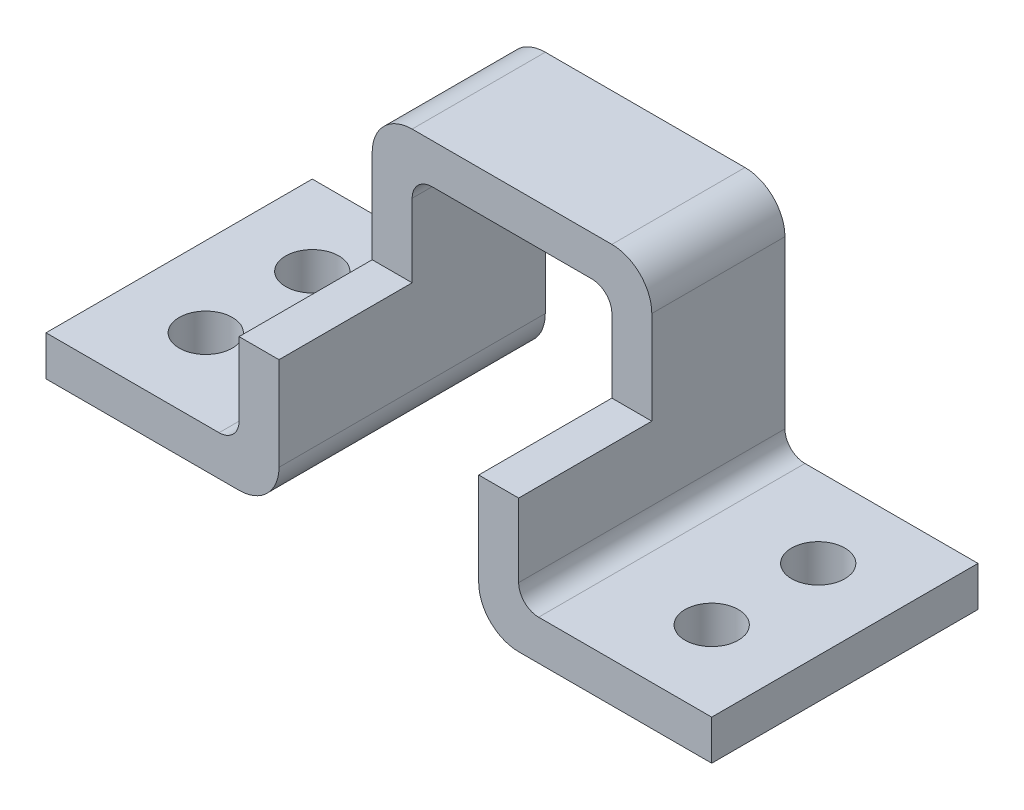
from build123d import *

# Parameters (mm, degrees)
BOSS_EXTRUDE1_DEPTH = 40
CUT_EXTRUDE1_START  = -20
CUT_EXTRUDE1_DEPTH  = 20
CUT_EXTRUDE2_REACH  = 114.942
SKETCH3_R           = 4


with BuildPart() as part:
    # Sketch1 → Boss-Extrude1 (new body)
    with BuildSketch(Plane.XY):
        with BuildLine():
            Line((0, 6), (0, 0))
            Line((0, 0), (29, 0))
            ThreePointArc((29, 0), (33.242640687, 1.757359313), (35, 6))
            Line((35, 6), (35, 31))
            ThreePointArc((35, 31), (35.878679656, 33.121320344), (38, 34))
            Line((38, 34), (62, 34))
            ThreePointArc((62, 34), (64.121320344, 33.121320344), (65, 31))
            Line((65, 31), (65, 6))
            ThreePointArc((65, 6), (66.757359313, 1.757359313), (71, 0))
            Line((71, 0), (100, 0))
            Line((100, 0), (100, 6))
            Line((100, 6), (74, 6))
            ThreePointArc((74, 6), (71.878679656, 6.878679656), (71, 9))
            Line((71, 9), (71, 34))
            ThreePointArc((71, 34), (69.242640687, 38.242640687), (65, 40))
            Line((65, 40), (35, 40))
            ThreePointArc((35, 40), (30.757359313, 38.242640687), (29, 34))
            Line((29, 34), (29, 9))
            ThreePointArc((29, 9), (28.121320344, 6.878679656), (26, 6))
            Line((26, 6), (0, 6))
        make_face()
    extrude(amount=BOSS_EXTRUDE1_DEPTH)

    # Sketch2 → Cut-Extrude1 (cut)
    with BuildSketch(Plane.XY.offset(40).offset(CUT_EXTRUDE1_START)):
        with BuildLine():
            Line((29, 20), (35, 20))
            Line((35, 20), (35, 31))
            ThreePointArc((35, 31), (35.878679656, 33.121320344), (38, 34))
            Line((38, 34), (62, 34))
            ThreePointArc((62, 34), (64.121320344, 33.121320344), (65, 31))
            Line((65, 31), (65, 20))
            Line((65, 20), (71, 20))
            Line((71, 20), (71, 34))
            ThreePointArc((71, 34), (69.242640687, 38.242640687), (65, 40))
            Line((65, 40), (35, 40))
            ThreePointArc((35, 40), (30.757359313, 38.242640687), (29, 34))
            Line((29, 34), (29, 20))
        make_face()
    extrude(amount=CUT_EXTRUDE1_DEPTH, mode=Mode.SUBTRACT)

    # Sketch3 → Cut-Extrude2 (cut, up to next)
    with BuildSketch(Plane(origin=(0, 6, 0), x_dir=(1, 0, 0), z_dir=(0, 1, 0)), mode=Mode.PRIVATE) as cut_extrude2_sk1:
        with Locations(Location((12, -12, 0), (0, 0, 180))):
            Circle(SKETCH3_R)
    cut_extrude2_tool1 = extrude(cut_extrude2_sk1.sketch, amount=-CUT_EXTRUDE2_REACH, mode=Mode.PRIVATE) & part.part
    # Sketch3 → Cut-Extrude2 (cut, up to next)
    with BuildSketch(Plane(origin=(0, 6, 0), x_dir=(1, 0, 0), z_dir=(0, 1, 0)), mode=Mode.PRIVATE) as cut_extrude2_sk2:
        with Locations(Location((12, -28, 0), (0, 0, 180))):
            Circle(SKETCH3_R)
    cut_extrude2_tool2 = extrude(cut_extrude2_sk2.sketch, amount=-CUT_EXTRUDE2_REACH, mode=Mode.PRIVATE) & part.part
    # Sketch3 → Cut-Extrude2 (cut, up to next)
    with BuildSketch(Plane(origin=(0, 6, 0), x_dir=(1, 0, 0), z_dir=(0, 1, 0)), mode=Mode.PRIVATE) as cut_extrude2_sk3:
        with Locations(Location((88, -12, 0), (0, 0, 180))):
            Circle(SKETCH3_R)
    cut_extrude2_tool3 = extrude(cut_extrude2_sk3.sketch, amount=-CUT_EXTRUDE2_REACH, mode=Mode.PRIVATE) & part.part
    # Sketch3 → Cut-Extrude2 (cut, up to next)
    with BuildSketch(Plane(origin=(0, 6, 0), x_dir=(1, 0, 0), z_dir=(0, 1, 0)), mode=Mode.PRIVATE) as cut_extrude2_sk4:
        with Locations(Location((88, -28, 0), (0, 0, 180))):
            Circle(SKETCH3_R)
    cut_extrude2_tool4 = extrude(cut_extrude2_sk4.sketch, amount=-CUT_EXTRUDE2_REACH, mode=Mode.PRIVATE) & part.part
    add(cut_extrude2_tool1.solids().sort_by_distance((12, 6, 12))[0], mode=Mode.SUBTRACT)
    add(cut_extrude2_tool2.solids().sort_by_distance((12, 6, 28))[0], mode=Mode.SUBTRACT)
    add(cut_extrude2_tool3.solids().sort_by_distance((88, 6, 12))[0], mode=Mode.SUBTRACT)
    add(cut_extrude2_tool4.solids().sort_by_distance((88, 6, 28))[0], mode=Mode.SUBTRACT)


solid = part.part
